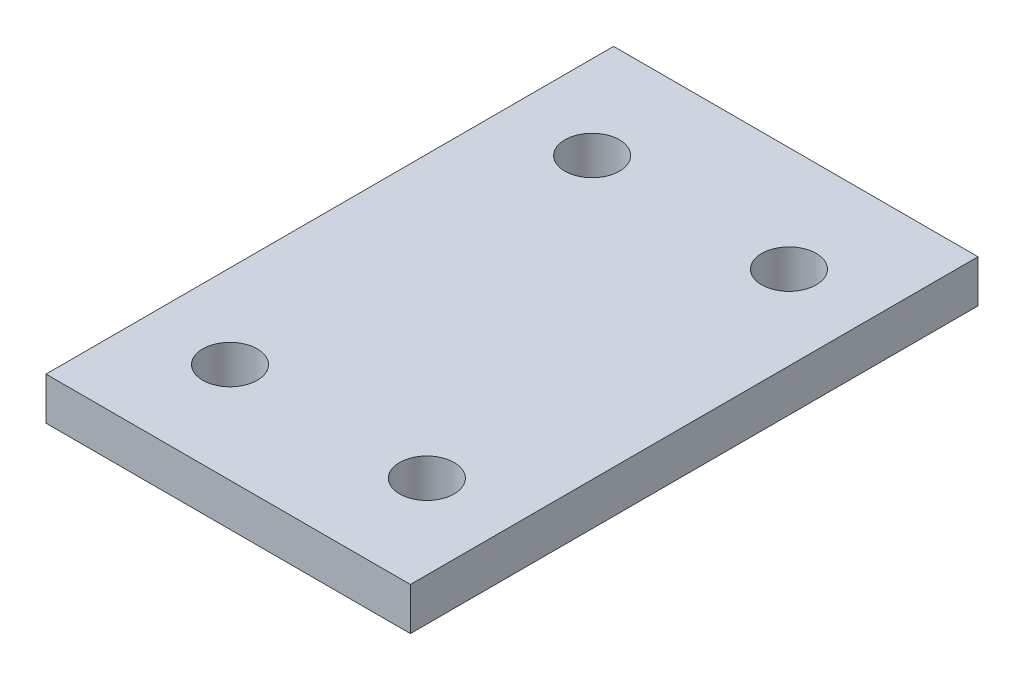
from build123d import *

# Parameters (mm, degrees)
SKETCH1_W           = 40.767
SKETCH1_H           = 63.5
SKETCH1_R           = 3.05
BOSS_EXTRUDE1_DEPTH = 4.7625


with BuildPart() as part:
    # Sketch1 → Boss-Extrude1 (new body)
    with BuildSketch(Plane(origin=(0, 0, 0), x_dir=(1, 0, 0), z_dir=(0, 1, 0))):
        Rectangle(SKETCH1_W, SKETCH1_H)
        with Locations(Location((11.0109, 19.9771, 0), (0, 0, 90))):
            Circle(SKETCH1_R, mode=Mode.SUBTRACT)
        with Locations(Location((11.0109, -20.5359, 0), (0, 0, 90))):
            Circle(SKETCH1_R, mode=Mode.SUBTRACT)
        with Locations(Location((-11.0109, -20.5359, 0), (0, 0, 90))):
            Circle(SKETCH1_R, mode=Mode.SUBTRACT)
        with Locations(Location((-11.0109, 19.9771, 0), (0, 0, 90))):
            Circle(SKETCH1_R, mode=Mode.SUBTRACT)
    extrude(amount=BOSS_EXTRUDE1_DEPTH)


solid = part.part
